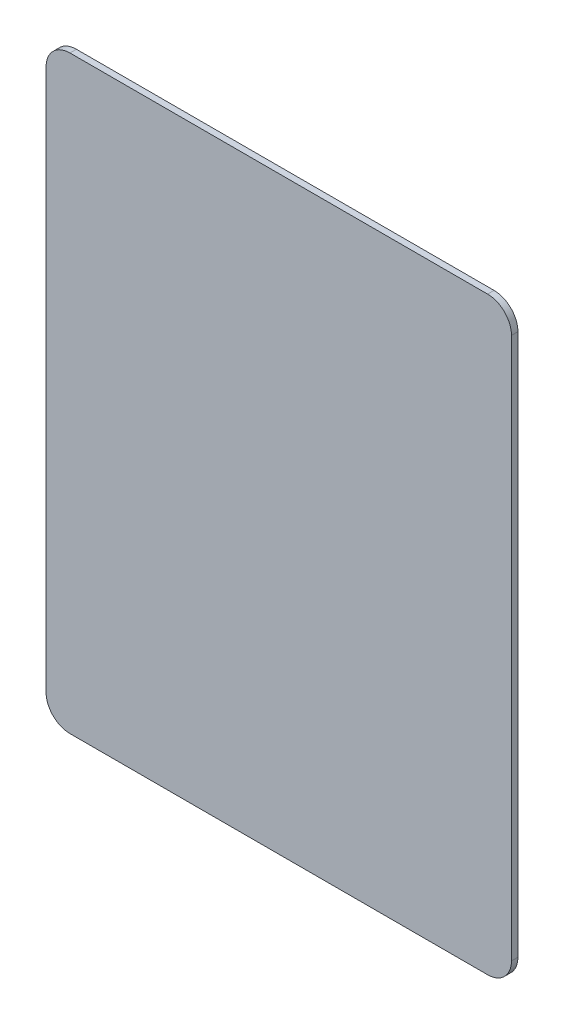
from build123d import *

# Parameters (mm, degrees)
BOSS_EXTRUDE1_DEPTH = 2.7


with BuildPart() as part:
    # Sketch2 → Boss-Extrude1 (new body)
    with BuildSketch(Plane.XY):
        with BuildLine():
            Line((61.259505675, 237), (236.259505675, 237))
            ThreePointArc((236.259505675, 237), (243.330573487, 234.071067812), (246.259505675, 227))
            Line((246.259505675, 227), (246.259505675, 0))
            ThreePointArc((246.259505675, 0), (243.330573487, -7.071067812), (236.259505675, -10))
            Line((236.259505675, -10), (61.259505675, -10))
            ThreePointArc((61.259505675, -10), (54.188437863, -7.071067812), (51.259505675, 0))
            Line((51.259505675, 0), (51.259505675, 227))
            ThreePointArc((51.259505675, 227), (54.188437863, 234.071067812), (61.259505675, 237))
        make_face()
    extrude(amount=BOSS_EXTRUDE1_DEPTH)


solid = part.part
